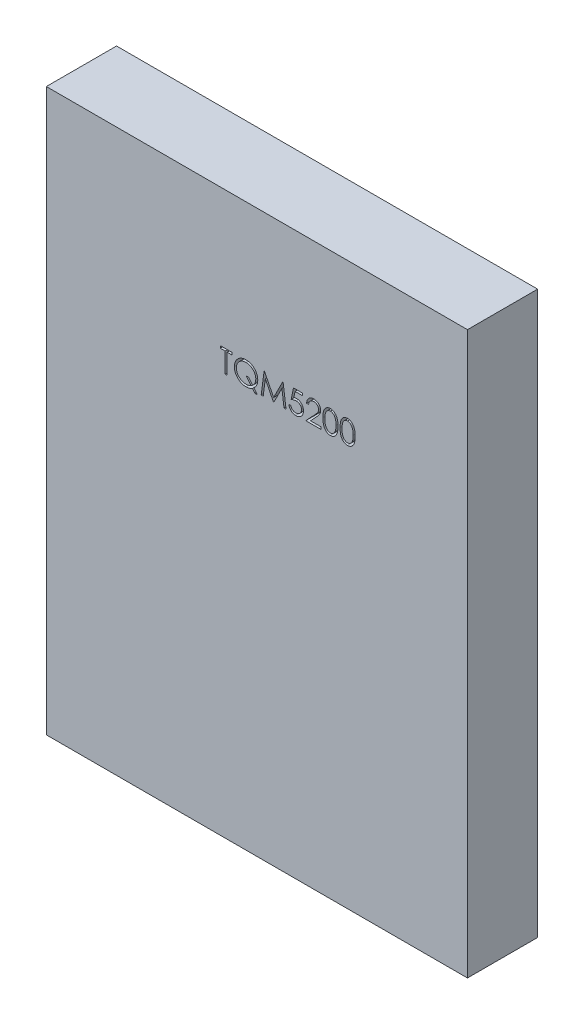
from build123d import *

# Parameters (mm, degrees)
SKETCH1_W      = 60
SKETCH1_H      = 80
EXTRUDE1_DEPTH = 10
EXTRUDE2_DEPTH = 51.990195136


with BuildPart() as part:
    # Sketch1 → Extrude1 (new body)
    with BuildSketch(Plane.XY):
        Rectangle(SKETCH1_W, SKETCH1_H)
    extrude(amount=EXTRUDE1_DEPTH)

    # Sketch2 → Extrude2 (cut, through all)
    # profile 1 of 7: a face of its own
    with BuildSketch(Plane.XY.offset(10)):
        Polygon((-5.209771412, 20.099295067), (-5.209771412, 20.424936093), (-3.540861155, 20.424936093), (-3.540861155, 20.099295067), (-4.232848335, 20.099295067), (-4.232848335, 17.249936093), (-4.517784232, 17.249936093), (-4.517784232, 20.099295067), align=None)
    # profile 2 of 7: a face of its own
    with BuildSketch(Plane.XY.offset(10)):
        with BuildLine():
            Line((-0.405930266, 17.603561894), (0.081895255, 17.005705324))
            Line((0.081895255, 17.005705324), (-0.273638599, 17.005705324))
            Line((-0.273638599, 17.005705324), (-0.625992365, 17.436925275))
            add(Edge.make_bspline(
                [(-0.625992365, 17.436925275), (-0.661332014, 17.415449815), (-0.731360326, 17.37289449), (-0.840550061, 17.318043039), (-0.951911191, 17.272399477), (-1.065197316, 17.234689572), (-1.180243431, 17.204505005), (-1.297632922, 17.183555639), (-1.416940027, 17.171390603), (-1.497097349, 17.169484399), (-1.537405626, 17.168525836)],
                knots=[0, 0, 0, 0, 1.030216282, 2.041455142, 3.041201647, 4.026904037, 5.014869161, 6.002481075, 6.995518502, 8, 8, 8, 8], degree=3))
            add(Edge.make_bspline(
                [(-1.537405626, 17.168525836), (-1.59515465, 17.169916801), (-1.708787537, 17.172653804), (-1.875674715, 17.196548361), (-2.035861283, 17.233451404), (-2.189027956, 17.286846435), (-2.335341583, 17.355047687), (-2.474734186, 17.439130102), (-2.607276616, 17.53792904), (-2.731012344, 17.65079882), (-2.844156116, 17.773585419), (-2.943432686, 17.904777361), (-3.027844593, 18.042197674), (-3.096096649, 18.18653163), (-3.150263777, 18.336522701), (-3.187177206, 18.493418314), (-3.211070838, 18.656284494), (-3.213823443, 18.767176513), (-3.21522013, 18.823443705)],
                knots=[0, 0, 0, 0, 1.055750571, 2.07740284, 3.077223765, 4.05828044, 5.038417088, 6.02463293, 7.030503776, 8.057169806, 9.083586829, 10.080154041, 11.061747002, 12.027853603, 12.995569715, 13.972756451, 14.971366004, 16, 16, 16, 16], degree=3))
            add(Edge.make_bspline(
                [(-3.21522013, 18.823443705), (-3.214723203, 18.861209227), (-3.213732843, 18.936474935), (-3.202276398, 19.047951155), (-3.185254959, 19.157592188), (-3.161178795, 19.26494241), (-3.129661089, 19.370441834), (-3.091874612, 19.473882431), (-3.046091266, 19.574997661), (-2.994334304, 19.673580574), (-2.936610446, 19.768776745), (-2.873730536, 19.859231278), (-2.805539886, 19.94405274), (-2.732086768, 20.02320232), (-2.653664532, 20.09685498), (-2.570947546, 20.166223558), (-2.482172117, 20.228727469), (-2.389681306, 20.286853599), (-2.292956433, 20.337967482), (-2.193889435, 20.38366166), (-2.091739236, 20.420736727), (-1.987831245, 20.452329176), (-1.881535063, 20.476448208), (-1.772933532, 20.493344868), (-1.662103055, 20.504911816), (-1.587256838, 20.505865252), (-1.549489961, 20.506346349)],
                knots=[0, 0, 0, 0, 1.030721839, 2.054201982, 3.056261636, 4.058906239, 5.055198403, 6.060579377, 7.06322398, 8.083343201, 9.098870418, 10.10084648, 11.0888991, 12.067804703, 13.046436456, 14.024708667, 15.012489976, 16.008294399, 17.005242112, 17.997338632, 18.984424362, 19.969624474, 20.960977749, 21.957320355, 22.969278161, 24, 24, 24, 24], degree=3))
            add(Edge.make_bspline(
                [(-1.549489961, 20.506346349), (-1.491740722, 20.504962368), (-1.378317521, 20.502244141), (-1.211843778, 20.47834598), (-1.052129111, 20.441294853), (-0.89928722, 20.388171936), (-0.753454374, 20.319798929), (-0.614691841, 20.235733462), (-0.482784486, 20.136927979), (-0.359695317, 20.024050641), (-0.24681802, 19.900961478), (-0.148012382, 19.76905414), (-0.063947482, 19.630291533), (0.004427623, 19.484458965), (0.057542645, 19.331616029), (0.094671482, 19.171700511), (0.118455533, 19.004997663), (0.12120373, 18.891367584), (0.122600383, 18.833619987)],
                knots=[0, 0, 0, 0, 1.050672203, 2.063587442, 3.054842799, 4.031180399, 5.003107577, 5.981273811, 6.979214548, 7.998088659, 9.016962771, 10.014903508, 10.993069742, 11.96499692, 12.941334519, 13.932589877, 14.949327797, 16, 16, 16, 16], degree=3))
            add(Edge.make_bspline(
                [(0.122600383, 18.833619987), (0.121074008, 18.773533233), (0.118072479, 18.655376034), (0.092528943, 18.482111091), (0.051459423, 18.316602253), (-0.006782117, 18.158957965), (-0.082075265, 18.009206879), (-0.172965416, 17.86585147), (-0.280546894, 17.728901902), (-0.363695658, 17.645781895), (-0.405930266, 17.603561894)],
                knots=[0, 0, 0, 0, 1.045660934, 2.056233022, 3.041853582, 4.009978652, 4.97562384, 5.954545411, 6.961031197, 8, 8, 8, 8], degree=3))
        make_face()
        with BuildLine():
            add(Edge.make_bspline(
                [(-0.597371572, 17.838252399), (-0.562728983, 17.873434096), (-0.494585474, 17.942638054), (-0.406170612, 18.056128883), (-0.33012496, 18.174100301), (-0.269242137, 18.298121607), (-0.220801551, 18.426638996), (-0.187334426, 18.560670791), (-0.166379352, 18.699606815), (-0.163693371, 18.794112373), (-0.162335514, 18.841888216)],
                knots=[0, 0, 0, 0, 1.052210109, 2.069743939, 3.061837814, 4.040478349, 5.010453814, 5.985306305, 6.981502329, 8, 8, 8, 8], degree=3))
            add(Edge.make_bspline(
                [(-0.162335514, 18.841888216), (-0.162690302, 18.872655266), (-0.163391655, 18.933476301), (-0.17303524, 19.023480763), (-0.186678046, 19.111497359), (-0.206428646, 19.197368829), (-0.231862567, 19.280921191), (-0.263275693, 19.362041024), (-0.30005599, 19.440990025), (-0.34293378, 19.517277768), (-0.390202914, 19.590793681), (-0.442819261, 19.660638701), (-0.500042213, 19.726452687), (-0.561246637, 19.789320222), (-0.627612553, 19.847945376), (-0.698901948, 19.902303016), (-0.774236376, 19.953708584), (-0.853988622, 20.000108746), (-0.936173288, 20.042766453), (-1.02030948, 20.079705388), (-1.105690731, 20.110991342), (-1.192184826, 20.136360233), (-1.279679838, 20.156328782), (-1.368329167, 20.169956321), (-1.457903562, 20.179589977), (-1.518087474, 20.180333224), (-1.548217926, 20.180705324)],
                knots=[0, 0, 0, 0, 1.032958288, 2.041976502, 3.037103433, 4.023477888, 4.998866292, 5.968231228, 6.943073582, 7.921783703, 8.90545537, 9.876780072, 10.85618943, 11.833110341, 12.821898168, 13.827467856, 14.842673888, 15.88323808, 16.924703457, 17.951432745, 18.967462636, 19.976958182, 20.977218729, 21.979378626, 22.98839684, 24, 24, 24, 24], degree=3))
            add(Edge.make_bspline(
                [(-1.548217926, 20.180705324), (-1.578559824, 20.180330628), (-1.639165682, 20.179582199), (-1.729172529, 20.170009604), (-1.818025307, 20.15631378), (-1.905333226, 20.136444478), (-1.991405473, 20.111026251), (-2.075974886, 20.079551156), (-2.159776926, 20.043524597), (-2.241072621, 20.000894127), (-2.319719734, 19.95409497), (-2.394518115, 19.903200541), (-2.464442705, 19.847703064), (-2.530156806, 19.788496046), (-2.591496287, 19.725122659), (-2.648750762, 19.658004458), (-2.700914742, 19.58636267), (-2.74870676, 19.511479078), (-2.790947613, 19.433272321), (-2.829043503, 19.353153437), (-2.859985827, 19.270239125), (-2.885388819, 19.18519303), (-2.906146909, 19.098226581), (-2.919526304, 19.008834943), (-2.929242227, 18.917576152), (-2.929934223, 18.855907534), (-2.930284232, 18.82471574)],
                knots=[0, 0, 0, 0, 1.013205451, 2.023808328, 3.020541854, 4.015386314, 5.012622987, 6.016502547, 7.02834558, 8.057881235, 9.080621846, 10.084476421, 11.077781791, 12.060654405, 13.037357686, 14.022218736, 15.005346502, 15.995617173, 16.98763393, 17.973029642, 18.956998942, 19.940662314, 20.93709383, 21.940823471, 22.958474994, 24, 24, 24, 24], degree=3))
            add(Edge.make_bspline(
                [(-2.930284232, 18.82471574), (-2.929092649, 18.778857028), (-2.926748435, 18.688638754), (-2.907315491, 18.556182756), (-2.87473372, 18.42937644), (-2.829150471, 18.308038394), (-2.771926953, 18.191469247), (-2.700765182, 18.080810987), (-2.615968753, 17.976485097), (-2.520745553, 17.877775001), (-2.415998611, 17.788347606), (-2.304956694, 17.709641735), (-2.18856785, 17.642866777), (-2.066466599, 17.588971594), (-1.939563456, 17.545691939), (-1.806856648, 17.516390748), (-1.669213686, 17.496969131), (-1.575422908, 17.495109703), (-1.527865362, 17.494166862)],
                knots=[0, 0, 0, 0, 1.022526523, 2.011626, 2.97850031, 3.937665323, 4.897797383, 5.869804095, 6.865337375, 7.89202157, 8.925035373, 9.93268082, 10.923937058, 11.912550332, 12.905497077, 13.90928476, 14.939882052, 16, 16, 16, 16], degree=3))
            add(Edge.make_bspline(
                [(-1.527865362, 17.494166862), (-1.495191524, 17.494522798), (-1.43056498, 17.495226815), (-1.33526599, 17.504824948), (-1.242299064, 17.518334517), (-1.1525251, 17.538881249), (-1.065165617, 17.564425355), (-0.980740607, 17.595497455), (-0.898802228, 17.63233369), (-0.846702229, 17.661475487), (-0.820613759, 17.676067904)],
                knots=[0, 0, 0, 0, 1.060694673, 2.097979151, 3.107774411, 4.11000626, 5.086069662, 6.061987343, 7.029562652, 8, 8, 8, 8], degree=3))
            Line((-0.820613759, 17.676067904), (-1.535497573, 18.552500195))
            Line((-1.535497573, 18.552500195), (-1.179963719, 18.552500195))
            Line((-1.179963719, 18.552500195), (-0.597371572, 17.838252399))
        make_face(mode=Mode.SUBTRACT)
    # profile 3 of 7: a face of its own
    with BuildSketch(Plane.XY.offset(10)):
        Polygon((0.611061922, 17.249936093), (1.030197539, 20.424936093), (1.070902667, 20.424936093), (2.381734999, 17.819807888), (3.689387242, 20.424936093), (3.730728388, 20.424936093), (4.152408076, 17.249936093), (3.866200143, 17.249936093), (3.562183717, 19.534511413), (2.416079951, 17.249936093), (2.35184217, 17.249936093), (1.201286281, 19.539599554), (0.897905872, 17.249936093), align=None)
    # profile 4 of 7: a face of its own
    with BuildSketch(Plane.XY.offset(10)):
        with BuildLine():
            Line((6.513305511, 20.424936093), (6.513305511, 20.099295067))
            Line((6.513305511, 20.099295067), (5.433347579, 20.099295067))
            Line((5.433347579, 20.099295067), (5.262258837, 19.264203921))
            add(Edge.make_bspline(
                [(5.262258837, 19.264203921), (5.295873809, 19.273484239), (5.3609975, 19.291463388), (5.457118231, 19.311425765), (5.54836973, 19.323459418), (5.607583816, 19.325102535), (5.636237202, 19.325897631)],
                knots=[0, 0, 0, 0, 1.100273476, 2.13160584, 3.095893838, 4, 4, 4, 4], degree=3))
            add(Edge.make_bspline(
                [(5.636237202, 19.325897631), (5.671691737, 19.325130247), (5.741404212, 19.323621377), (5.8434024, 19.309132628), (5.940768667, 19.286327134), (6.033299389, 19.254467803), (6.121165745, 19.21372826), (6.203559319, 19.1628376), (6.281716854, 19.103389506), (6.354236207, 19.035040817), (6.420026116, 18.959819065), (6.477870978, 18.878940139), (6.527004185, 18.793190045), (6.566520012, 18.701749493), (6.598074373, 18.605629404), (6.619076539, 18.503818418), (6.633061697, 18.397276195), (6.634624147, 18.324428478), (6.635420896, 18.287280844)],
                knots=[0, 0, 0, 0, 1.052922333, 2.070308379, 3.05430497, 4.020497103, 4.973039431, 5.925935799, 6.892292201, 7.88610001, 8.88166317, 9.857072816, 10.836096531, 11.812156883, 12.81219415, 13.836441305, 14.89672472, 16, 16, 16, 16], degree=3))
            add(Edge.make_bspline(
                [(6.635420896, 18.287280844), (6.634817578, 18.261407116), (6.633619095, 18.21000932), (6.627524376, 18.133678509), (6.615789833, 18.058963654), (6.600034826, 17.985854841), (6.579585633, 17.914490482), (6.554830563, 17.84466631), (6.524535595, 17.776816917), (6.491305704, 17.710300309), (6.453889257, 17.646620234), (6.412361611, 17.587067225), (6.368487201, 17.530747913), (6.32127823, 17.478266312), (6.270295898, 17.429967289), (6.216157643, 17.385564205), (6.159295462, 17.344306141), (6.098829635, 17.307867849), (6.036107525, 17.274337168), (5.970223357, 17.246829387), (5.902676864, 17.222236266), (5.83249587, 17.202633337), (5.75983934, 17.187273091), (5.684587508, 17.176840403), (5.607135043, 17.169241778), (5.554634139, 17.168766111), (5.528114205, 17.168525836)],
                knots=[0, 0, 0, 0, 1.056347294, 2.098418968, 3.122841568, 4.141288669, 5.149314143, 6.15115421, 7.162517403, 8.180376062, 9.185164535, 10.17417709, 11.141909838, 12.097768115, 13.052685741, 14.0056014, 14.954263652, 15.917497458, 16.885230207, 17.854509472, 18.828990115, 19.81800267, 20.826176721, 21.857883937, 22.917946725, 24, 24, 24, 24], degree=3))
            add(Edge.make_bspline(
                [(5.528114205, 17.168525836), (5.496478341, 17.169152525), (5.434238516, 17.170385461), (5.343052002, 17.183283659), (5.255318038, 17.20175664), (5.171742875, 17.229548113), (5.091577514, 17.264370873), (5.015901192, 17.308381972), (4.942780238, 17.358255873), (4.875187176, 17.417111622), (4.812452702, 17.481442276), (4.756294654, 17.551253851), (4.706280624, 17.62539413), (4.663211525, 17.70422317), (4.626474034, 17.787533837), (4.597613295, 17.875638274), (4.574319359, 17.968076135), (4.564464684, 18.031715391), (4.559459358, 18.064038657)],
                knots=[0, 0, 0, 0, 1.0467383, 2.05933395, 3.04377827, 4.011590433, 4.970194871, 5.932262533, 6.905835911, 7.896367577, 8.894135286, 9.877477877, 10.858688626, 11.851381753, 12.8477658, 13.868841284, 14.917554742, 16, 16, 16, 16], degree=3))
            Line((4.559459358, 18.064038657), (4.844395255, 18.064038657))
            add(Edge.make_bspline(
                [(4.844395255, 18.064038657), (4.851406161, 18.033761446), (4.864881511, 17.975566967), (4.894459583, 17.893804964), (4.930623627, 17.820943954), (4.973626143, 17.756020118), (5.024925099, 17.699406242), (5.08346251, 17.648953621), (5.14909223, 17.603437611), (5.222020374, 17.565498387), (5.298957953, 17.533141732), (5.379482494, 17.511595551), (5.461401436, 17.496445456), (5.516808244, 17.49492893), (5.544650664, 17.494166862)],
                knots=[0, 0, 0, 0, 1.136247022, 2.183929868, 3.172523383, 4.106158343, 5.02341133, 5.958108904, 6.928429099, 7.938127109, 8.96079061, 9.975095812, 10.982467395, 12, 12, 12, 12], degree=3))
            add(Edge.make_bspline(
                [(5.544650664, 17.494166862), (5.571827253, 17.494911425), (5.625338178, 17.496377475), (5.704088508, 17.507661436), (5.780118758, 17.52504009), (5.852678717, 17.551047744), (5.923038114, 17.582656882), (5.989417177, 17.623219843), (6.053736216, 17.669901431), (6.113996022, 17.723383517), (6.169186094, 17.782320312), (6.217950576, 17.845346233), (6.258569633, 17.912580801), (6.29279986, 17.982860018), (6.318792496, 18.056954138), (6.337335386, 18.134515918), (6.348223875, 18.215736936), (6.349721731, 18.271135524), (6.350484999, 18.299365179)],
                knots=[0, 0, 0, 0, 1.027316725, 2.022795036, 3.002884548, 3.971462791, 4.93288096, 5.914575861, 6.907176829, 7.935150275, 8.956128384, 9.956726525, 10.942570165, 11.921478529, 12.907843606, 13.90538589, 14.932640048, 16, 16, 16, 16], degree=3))
            add(Edge.make_bspline(
                [(6.350484999, 18.299365179), (6.349887664, 18.324833897), (6.348718466, 18.374685288), (6.339165734, 18.447618853), (6.322549623, 18.51662797), (6.299486532, 18.582045883), (6.270204407, 18.643934291), (6.234420967, 18.702357067), (6.19146467, 18.756544187), (6.1423956, 18.806521004), (6.088640091, 18.852644569), (6.029273268, 18.891963847), (5.965537477, 18.92504183), (5.898200626, 18.9535878), (5.825661039, 18.974089904), (5.749355237, 18.9894822), (5.668459223, 18.998386137), (5.613150099, 18.999621564), (5.584719774, 19.000256606)],
                knots=[0, 0, 0, 0, 1.045622112, 2.046656509, 3.013763289, 3.955457236, 4.890082067, 5.820317437, 6.762574623, 7.722996705, 8.69280354, 9.665887285, 10.63943826, 11.638615906, 12.663482002, 13.728887084, 14.832589034, 16, 16, 16, 16], degree=3))
            add(Edge.make_bspline(
                [(5.584719774, 19.000256606), (5.56010996, 18.999729926), (5.509296938, 18.998642468), (5.431352659, 18.990635574), (5.349445168, 18.9777185), (5.263888447, 18.959950975), (5.174425557, 18.936699927), (5.081245294, 18.908837487), (4.984151738, 18.875525389), (4.918730659, 18.850368309), (4.885100383, 18.837436093)],
                knots=[0, 0, 0, 0, 0.817624296, 1.688186739, 2.600797293, 3.572016777, 4.590301741, 5.671205678, 6.80286297, 8, 8, 8, 8], degree=3))
            Line((4.885100383, 18.837436093), (5.210741409, 20.424936093))
            Line((5.210741409, 20.424936093), (6.513305511, 20.424936093))
        make_face()
    # profile 5 of 7: a face of its own
    with BuildSketch(Plane.XY.offset(10)):
        with BuildLine():
            Line((7.368113204, 19.448013016), (7.083177306, 19.448013016))
            add(Edge.make_bspline(
                [(7.083177306, 19.448013016), (7.085034367, 19.485814464), (7.088681583, 19.560055502), (7.105761532, 19.668299332), (7.130200756, 19.771763328), (7.164755146, 19.86961675), (7.207668698, 19.96272481), (7.259130937, 20.050717682), (7.320085359, 20.133259689), (7.389215753, 20.209585639), (7.464298733, 20.279605793), (7.545311978, 20.34007162), (7.630442824, 20.391159794), (7.719432993, 20.433869206), (7.813286505, 20.465927495), (7.911151669, 20.489714268), (8.013458457, 20.504025667), (8.083163334, 20.505563987), (8.118614005, 20.506346349)],
                knots=[0, 0, 0, 0, 1.10065271, 2.161652631, 3.183658789, 4.190468796, 5.17591951, 6.163126047, 7.15150782, 8.156236427, 9.156009102, 10.134482811, 11.092018607, 12.041330605, 13.001268258, 13.972401359, 14.968799086, 16, 16, 16, 16], degree=3))
            add(Edge.make_bspline(
                [(8.118614005, 20.506346349), (8.153428401, 20.505531321), (8.221837445, 20.503929819), (8.321679415, 20.4901766), (8.416727389, 20.468635956), (8.506795578, 20.438414114), (8.591165365, 20.397788241), (8.670470555, 20.348986188), (8.745655291, 20.292543912), (8.813334302, 20.226092238), (8.875480916, 20.155151504), (8.929095105, 20.079416049), (8.975008475, 20.001193768), (9.013278727, 19.919888185), (9.041451082, 19.834733752), (9.062839885, 19.746970218), (9.074929753, 19.65568914), (9.076785244, 19.593906764), (9.077728588, 19.562496189)],
                knots=[0, 0, 0, 0, 1.111607364, 2.184268762, 3.212621178, 4.221274766, 5.211760367, 6.196651075, 7.1921475, 8.207485113, 9.220403448, 10.201281604, 11.166441695, 12.114753415, 13.065576456, 14.026450734, 14.996634279, 16, 16, 16, 16], degree=3))
            add(Edge.make_bspline(
                [(9.077728588, 19.562496189), (9.076192557, 19.518274939), (9.07314745, 19.430608459), (9.047099408, 19.301780691), (9.006417216, 19.176963804), (8.957433899, 19.076509251), (8.908019611, 18.995561725), (8.863490229, 18.928915114), (8.811361436, 18.857155153), (8.750874513, 18.78052214), (8.683280693, 18.698415819), (8.607967731, 18.61088579), (8.524398572, 18.518836399), (8.465744075, 18.455966318), (8.435350784, 18.423388617)],
                knots=[0, 0, 0, 0, 1.184426356, 2.348067706, 3.509069118, 4.696110526, 5.333549288, 6.050745305, 6.844228056, 7.710549037, 8.667450064, 9.695053472, 10.805634456, 12, 12, 12, 12], degree=3))
            Line((8.435350784, 18.423388617), (7.640964766, 17.575577118))
            Line((7.640964766, 17.575577118), (9.118433717, 17.575577118))
            Line((9.118433717, 17.575577118), (9.118433717, 17.249936093))
            Line((9.118433717, 17.249936093), (6.961061922, 17.249936093))
            Line((6.961061922, 17.249936093), (8.19239205, 18.563948513))
            add(Edge.make_bspline(
                [(8.19239205, 18.563948513), (8.222371204, 18.595243405), (8.279955025, 18.655354489), (8.361400648, 18.743114174), (8.43455173, 18.824529829), (8.499881794, 18.899447626), (8.555973616, 18.968963406), (8.60575057, 19.030825744), (8.645633641, 19.087752995), (8.688918322, 19.153739123), (8.730841005, 19.234304583), (8.766865785, 19.332760144), (8.788832112, 19.434112723), (8.791467213, 19.502603856), (8.792792691, 19.537055484)],
                knots=[0, 0, 0, 0, 1.329631726, 2.553950428, 3.673215718, 4.687767853, 5.603093632, 6.413772471, 7.123043292, 7.734684054, 8.834405432, 9.900288307, 10.943827018, 12, 12, 12, 12], degree=3))
            add(Edge.make_bspline(
                [(8.792792691, 19.537055484), (8.792215982, 19.558719324), (8.791079399, 19.601414592), (8.781048488, 19.664012674), (8.765889671, 19.724396469), (8.744167902, 19.782751716), (8.715496073, 19.838491701), (8.680595221, 19.891684272), (8.640327092, 19.943109262), (8.593744155, 19.991326897), (8.542570848, 20.035487705), (8.48851035, 20.074607411), (8.431314898, 20.107300033), (8.371225645, 20.134100205), (8.308410112, 20.155123586), (8.242746807, 20.169691012), (8.174417164, 20.178837265), (8.127759636, 20.180074764), (8.1039856, 20.180705324)],
                knots=[0, 0, 0, 0, 0.991446411, 1.95395049, 2.89581595, 3.838931463, 4.798493298, 5.75982156, 6.748411868, 7.785213223, 8.824556874, 9.840280684, 10.836137867, 11.835679398, 12.848801643, 13.863922112, 14.911575587, 16, 16, 16, 16], degree=3))
            add(Edge.make_bspline(
                [(8.1039856, 20.180705324), (8.079156344, 20.180056687), (8.030395786, 20.178782872), (7.958804949, 20.169872313), (7.890509994, 20.154500015), (7.825339125, 20.13347546), (7.763182072, 20.106752348), (7.704341118, 20.073467694), (7.648948354, 20.033749811), (7.596899651, 19.988718735), (7.54894447, 19.938583125), (7.506810518, 19.882694087), (7.469995019, 19.822072075), (7.437873786, 19.756880661), (7.411788267, 19.686528303), (7.391855481, 19.611264742), (7.376083127, 19.531416775), (7.370813969, 19.476276019), (7.368113204, 19.448013016)],
                knots=[0, 0, 0, 0, 1.031018746, 2.02475058, 2.990194455, 3.934040569, 4.864654155, 5.795059489, 6.735614925, 7.690564532, 8.649604399, 9.611025574, 10.590972636, 11.591080095, 12.624614302, 13.701020113, 14.821632451, 16, 16, 16, 16], degree=3))
        make_face()
    # profile 6 of 7: a face of its own
    with BuildSketch(Plane.XY.offset(10)):
        with BuildLine():
            add(Edge.make_bspline(
                [(9.403369614, 18.836164058), (9.403667173, 18.887052402), (9.404245187, 18.985903745), (9.410675397, 19.129944099), (9.421357315, 19.265072361), (9.435996217, 19.391294999), (9.453810671, 19.5086446), (9.477591862, 19.616807558), (9.504636333, 19.716284487), (9.535980338, 19.807399774), (9.571347832, 19.891380976), (9.609841768, 19.96978098), (9.652989832, 20.042481162), (9.698326031, 20.110641871), (9.747685554, 20.173147366), (9.799663742, 20.230880353), (9.856289301, 20.282506534), (9.915637316, 20.329538536), (9.978245109, 20.3707677), (10.042328099, 20.407083113), (10.108327373, 20.438107278), (10.176423125, 20.462500745), (10.246003302, 20.482649156), (10.317311141, 20.496427701), (10.390464379, 20.505097183), (10.439841466, 20.50592601), (10.464883036, 20.506346349)],
                knots=[0, 0, 0, 0, 1.646270934, 3.197905019, 4.663502075, 6.030701355, 7.308322542, 8.50163776, 9.611534131, 10.641858119, 11.616356847, 12.558055219, 13.465016945, 14.349605745, 15.204443733, 16.039544428, 16.859896111, 17.680448484, 18.487036065, 19.28249412, 20.06191084, 20.843045899, 21.620316918, 22.403196591, 23.190181807, 24, 24, 24, 24], degree=3))
            add(Edge.make_bspline(
                [(10.464883036, 20.506346349), (10.490133791, 20.505903831), (10.540349599, 20.505023802), (10.614590511, 20.496565654), (10.687116294, 20.482531135), (10.757617748, 20.46264568), (10.826673986, 20.437975316), (10.89374487, 20.407053431), (10.959247008, 20.37105903), (11.022139483, 20.328764513), (11.083112741, 20.281609162), (11.140669108, 20.228303027), (11.194813822, 20.169384353), (11.24622642, 20.105483519), (11.293448283, 20.035374907), (11.338418468, 19.960277893), (11.378670244, 19.87887918), (11.417436699, 19.792536898), (11.450898465, 19.698862008), (11.481075702, 19.598382546), (11.505458767, 19.489911677), (11.525769035, 19.374018511), (11.541503333, 19.250277437), (11.552962945, 19.118953708), (11.559016386, 18.979960925), (11.560156393, 18.884930591), (11.560741409, 18.836164058)],
                knots=[0, 0, 0, 0, 0.810914788, 1.612654377, 2.396697861, 3.181598691, 3.963628158, 4.749916497, 5.551656086, 6.361998678, 7.18212741, 8.025565596, 8.878627764, 9.750805457, 10.657531673, 11.591944965, 12.560506719, 13.57287815, 14.630710178, 15.753379473, 16.941251878, 18.199788006, 19.531962791, 20.947069417, 22.433333509, 24, 24, 24, 24], degree=3))
            add(Edge.make_bspline(
                [(11.560741409, 18.836164058), (11.560150329, 18.787610227), (11.558998633, 18.693005068), (11.553030806, 18.554637683), (11.541275476, 18.424010886), (11.526570701, 18.300811395), (11.50620447, 18.185551984), (11.481162641, 18.077833806), (11.45335842, 17.977191684), (11.419036856, 17.884450105), (11.381471426, 17.798315327), (11.340599927, 17.717881557), (11.296812299, 17.642437849), (11.249106795, 17.572588078), (11.198258341, 17.507837439), (11.143178633, 17.449328882), (11.085420316, 17.395652629), (11.024267625, 17.347890082), (10.960394289, 17.30608458), (10.895117126, 17.26869773), (10.827277914, 17.238550928), (10.758414022, 17.21266557), (10.687540432, 17.192889445), (10.614745492, 17.179215305), (10.540399478, 17.169625128), (10.490142344, 17.168893536), (10.464883036, 17.168525836)],
                knots=[0, 0, 0, 0, 1.561518951, 3.042555995, 4.452378317, 5.7783523, 7.031515105, 8.214008947, 9.334062868, 10.386615937, 11.391082383, 12.354592575, 13.286541444, 14.194233754, 15.072674879, 15.931287219, 16.775624067, 17.606195743, 18.42308326, 19.229000347, 20.022332153, 20.807536673, 21.593273796, 22.3848459, 23.188221202, 24, 24, 24, 24], degree=3))
            add(Edge.make_bspline(
                [(10.464883036, 17.168525836), (10.439842161, 17.168948887), (10.390466443, 17.169783061), (10.317303172, 17.178413375), (10.246289812, 17.192288581), (10.177075942, 17.211716501), (10.109306461, 17.235497102), (10.043904829, 17.266479373), (9.980143859, 17.302160992), (9.918193662, 17.342796839), (9.859218344, 17.389352937), (9.802886038, 17.440846256), (9.750611914, 17.498561779), (9.701958127, 17.561588181), (9.655717347, 17.629345622), (9.613181987, 17.702759218), (9.573838426, 17.781537872), (9.537876117, 17.866190548), (9.505991258, 17.957952518), (9.477826551, 18.057873558), (9.455588709, 18.1668356), (9.43655417, 18.283963497), (9.421201337, 18.409760562), (9.410719914, 18.54429509), (9.404241721, 18.687483244), (9.403665621, 18.785699396), (9.403369614, 18.836164058)],
                knots=[0, 0, 0, 0, 0.810891512, 1.598919785, 2.382837074, 3.152667961, 3.926044502, 4.706494248, 5.493654104, 6.291793342, 7.103789334, 7.925228297, 8.761435821, 9.622817696, 10.50288917, 11.416980706, 12.369136599, 13.353924996, 14.394355917, 15.514179734, 16.714354668, 17.994756427, 19.357759367, 20.818452758, 22.365282078, 24, 24, 24, 24], degree=3))
        make_face()
        with BuildLine():
            add(Edge.make_bspline(
                [(9.688305511, 18.837436093), (9.688413867, 18.795028345), (9.688624164, 18.712723232), (9.694118003, 18.59312256), (9.701602142, 18.481570905), (9.711255319, 18.377926625), (9.725590851, 18.282540542), (9.741653437, 18.194756616), (9.761200632, 18.115039408), (9.784328256, 18.042841894), (9.810670865, 17.97693881), (9.839432613, 17.915614851), (9.870330554, 17.858145594), (9.904910069, 17.805047249), (9.942570162, 17.756146658), (9.98246019, 17.710578303), (10.026068892, 17.669941041), (10.086397287, 17.621203108), (10.166041231, 17.570839322), (10.266389787, 17.526982512), (10.369503311, 17.499421284), (10.439490516, 17.495916305), (10.4744233, 17.494166862)],
                knots=[0, 0, 0, 0, 1.459021318, 2.831673884, 4.118529203, 5.306027144, 6.411944654, 7.436330062, 8.375795394, 9.233974572, 10.042671642, 10.816086306, 11.563610507, 12.285937304, 12.993564865, 13.685989202, 14.367179055, 15.041617293, 16.353048772, 17.594441528, 18.799311195, 20, 20, 20, 20], degree=3))
            add(Edge.make_bspline(
                [(10.4744233, 17.494166862), (10.509582045, 17.495616277), (10.579826945, 17.498512116), (10.682455459, 17.52645097), (10.782087204, 17.568605481), (10.86016675, 17.618450718), (10.919568772, 17.665919989), (10.962129184, 17.706391848), (11.001192614, 17.751708956), (11.03824221, 17.800603318), (11.072222943, 17.854009071), (11.103123075, 17.911669407), (11.131320112, 17.973744447), (11.147384747, 18.017078425), (11.15559818, 18.039233969)],
                knots=[0, 0, 0, 0, 1.353760809, 2.704726607, 4.075137775, 5.516104923, 6.260822281, 7.007110065, 7.778089737, 8.566572457, 9.372053459, 10.217411131, 11.088608312, 12, 12, 12, 12], degree=3))
            add(Edge.make_bspline(
                [(11.15559818, 18.039233969), (11.165170141, 18.067563804), (11.184605326, 18.125085519), (11.20965315, 18.214315404), (11.229379333, 18.307935054), (11.247126101, 18.405384981), (11.25923923, 18.507383853), (11.268989032, 18.613616072), (11.27473187, 18.724161737), (11.275443751, 18.799268622), (11.275805511, 18.837436093)],
                knots=[0, 0, 0, 0, 0.884706709, 1.796334032, 2.740027952, 3.714592787, 4.726048262, 5.777819803, 6.87074269, 8, 8, 8, 8], degree=3))
            add(Edge.make_bspline(
                [(11.275805511, 18.837436093), (11.275306411, 18.875597391), (11.274330064, 18.950249047), (11.27059809, 19.059576254), (11.26096099, 19.163414866), (11.250257504, 19.262212223), (11.234475739, 19.355421426), (11.217459728, 19.443822775), (11.194598629, 19.52632109), (11.170178547, 19.604207996), (11.142229117, 19.67659859), (11.111462701, 19.743830382), (11.078604391, 19.806227954), (11.042915359, 19.863620108), (11.004819275, 19.916263915), (10.963310641, 19.963103868), (10.92003596, 20.005591689), (10.859423227, 20.054089877), (10.78007155, 20.103539772), (10.681332998, 20.149047283), (10.578580342, 20.17518052), (10.50911728, 20.17886505), (10.4744233, 20.180705324)],
                knots=[0, 0, 0, 0, 1.31362396, 2.569729283, 3.763502607, 4.902122613, 5.988968491, 7.01645872, 7.998833611, 8.933434873, 9.825090667, 10.667526885, 11.477055099, 12.250526234, 12.991942729, 13.710640831, 14.402115721, 15.076753259, 16.378508321, 17.609869233, 18.806226677, 20, 20, 20, 20], degree=3))
            add(Edge.make_bspline(
                [(10.4744233, 20.180705324), (10.439307263, 20.178862511), (10.369011216, 20.175173529), (10.265190571, 20.149144649), (10.165673052, 20.103775745), (10.086531211, 20.053926092), (10.025876204, 20.006447767), (9.983165475, 19.965275769), (9.943118591, 19.920239524), (9.906227177, 19.870889216), (9.871674756, 19.817852776), (9.83994198, 19.760712968), (9.811351259, 19.69918023), (9.78496743, 19.633306749), (9.761769258, 19.561115464), (9.74263402, 19.481496448), (9.724956479, 19.393991732), (9.712442199, 19.298089036), (9.701317221, 19.194418797), (9.694167713, 19.082588658), (9.688605786, 18.962787399), (9.688407608, 18.880056733), (9.688305511, 18.837436093)],
                knots=[0, 0, 0, 0, 1.207732386, 2.417664972, 3.655092373, 4.956220595, 5.625982001, 6.301752483, 6.994047911, 7.697131622, 8.419323945, 9.170223765, 9.943494443, 10.752040957, 11.610060368, 12.549350801, 13.567764191, 14.679664412, 15.874934091, 17.154273443, 18.533957287, 20, 20, 20, 20], degree=3))
        make_face(mode=Mode.SUBTRACT)
    # profile 7 of 7: a face of its own
    with BuildSketch(Plane.XY.offset(10)):
        with BuildLine():
            add(Edge.make_bspline(
                [(11.845677306, 18.836164058), (11.845974866, 18.887052402), (11.846552879, 18.985903745), (11.852983089, 19.129944099), (11.863665007, 19.265072361), (11.87830391, 19.391294999), (11.896118363, 19.5086446), (11.919899554, 19.616807558), (11.946944025, 19.716284487), (11.97828803, 19.807399774), (12.013655524, 19.891380976), (12.052149461, 19.96978098), (12.095297524, 20.042481162), (12.140633724, 20.110641871), (12.189993246, 20.173147366), (12.241971434, 20.230880353), (12.298596994, 20.282506534), (12.357945008, 20.329538536), (12.420552801, 20.3707677), (12.484635791, 20.407083113), (12.550635066, 20.438107278), (12.618730817, 20.462500745), (12.688310995, 20.482649156), (12.759618834, 20.496427701), (12.832772071, 20.505097183), (12.882149158, 20.50592601), (12.907190728, 20.506346349)],
                knots=[0, 0, 0, 0, 1.646270934, 3.197905019, 4.663502075, 6.030701355, 7.308322542, 8.50163776, 9.611534131, 10.641858119, 11.616356847, 12.558055219, 13.465016945, 14.349605745, 15.204443733, 16.039544428, 16.859896111, 17.680448484, 18.487036065, 19.28249412, 20.06191084, 20.843045899, 21.620316918, 22.403196591, 23.190181807, 24, 24, 24, 24], degree=3))
            add(Edge.make_bspline(
                [(12.907190728, 20.506346349), (12.932441483, 20.505903831), (12.982657291, 20.505023802), (13.056898203, 20.496565654), (13.129423986, 20.482531135), (13.19992544, 20.46264568), (13.268981678, 20.437975316), (13.336052562, 20.407053431), (13.4015547, 20.37105903), (13.464447176, 20.328764513), (13.525420434, 20.281609162), (13.5829768, 20.228303027), (13.637121514, 20.169384353), (13.688534112, 20.105483519), (13.735755975, 20.035374907), (13.78072616, 19.960277893), (13.820977936, 19.87887918), (13.859744391, 19.792536898), (13.893206158, 19.698862008), (13.923383394, 19.598382546), (13.947766459, 19.489911677), (13.968076727, 19.374018511), (13.983811026, 19.250277437), (13.995270637, 19.118953708), (14.001324078, 18.979960925), (14.002464086, 18.884930591), (14.003049101, 18.836164058)],
                knots=[0, 0, 0, 0, 0.810914788, 1.612654377, 2.396697861, 3.181598691, 3.963628158, 4.749916497, 5.551656086, 6.361998678, 7.18212741, 8.025565596, 8.878627764, 9.750805457, 10.657531673, 11.591944965, 12.560506719, 13.57287815, 14.630710178, 15.753379473, 16.941251878, 18.199788006, 19.531962791, 20.947069417, 22.433333509, 24, 24, 24, 24], degree=3))
            add(Edge.make_bspline(
                [(14.003049101, 18.836164058), (14.002458021, 18.787610227), (14.001306325, 18.693005068), (13.995338498, 18.554637683), (13.983583169, 18.424010886), (13.968878393, 18.300811395), (13.948512163, 18.185551984), (13.923470333, 18.077833806), (13.895666112, 17.977191684), (13.861344549, 17.884450105), (13.823779119, 17.798315327), (13.782907619, 17.717881557), (13.739119991, 17.642437849), (13.691414487, 17.572588078), (13.640566034, 17.507837439), (13.585486325, 17.449328882), (13.527728009, 17.395652629), (13.466575317, 17.347890082), (13.402701981, 17.30608458), (13.337424819, 17.26869773), (13.269585607, 17.238550928), (13.200721714, 17.21266557), (13.129848125, 17.192889445), (13.057053184, 17.179215305), (12.98270717, 17.169625128), (12.932450036, 17.168893536), (12.907190728, 17.168525836)],
                knots=[0, 0, 0, 0, 1.561518951, 3.042555995, 4.452378317, 5.7783523, 7.031515105, 8.214008947, 9.334062868, 10.386615937, 11.391082383, 12.354592575, 13.286541444, 14.194233754, 15.072674879, 15.931287219, 16.775624067, 17.606195743, 18.42308326, 19.229000347, 20.022332153, 20.807536673, 21.593273796, 22.3848459, 23.188221202, 24, 24, 24, 24], degree=3))
            add(Edge.make_bspline(
                [(12.907190728, 17.168525836), (12.882149853, 17.168948887), (12.832774136, 17.169783061), (12.759610864, 17.178413375), (12.688597504, 17.192288581), (12.619383635, 17.211716501), (12.551614153, 17.235497102), (12.486212522, 17.266479373), (12.422451552, 17.302160992), (12.360501354, 17.342796839), (12.301526037, 17.389352937), (12.245193731, 17.440846256), (12.192919606, 17.498561779), (12.144265819, 17.561588181), (12.098025039, 17.629345622), (12.055489679, 17.702759218), (12.016146119, 17.781537872), (11.980183809, 17.866190548), (11.94829895, 17.957952518), (11.920134244, 18.057873558), (11.897896401, 18.1668356), (11.878861863, 18.283963497), (11.86350903, 18.409760562), (11.853027606, 18.54429509), (11.846549413, 18.687483244), (11.845973313, 18.785699396), (11.845677306, 18.836164058)],
                knots=[0, 0, 0, 0, 0.810891512, 1.598919785, 2.382837074, 3.152667961, 3.926044502, 4.706494248, 5.493654104, 6.291793342, 7.103789334, 7.925228297, 8.761435821, 9.622817696, 10.50288917, 11.416980706, 12.369136599, 13.353924996, 14.394355917, 15.514179734, 16.714354668, 17.994756427, 19.357759367, 20.818452758, 22.365282078, 24, 24, 24, 24], degree=3))
        make_face()
        with BuildLine():
            add(Edge.make_bspline(
                [(12.130613204, 18.837436093), (12.130721559, 18.795028345), (12.130931856, 18.712723232), (12.136425695, 18.59312256), (12.143909834, 18.481570905), (12.153563011, 18.377926625), (12.167898543, 18.282540542), (12.183961129, 18.194756616), (12.203508325, 18.115039408), (12.226635948, 18.042841894), (12.252978557, 17.97693881), (12.281740305, 17.915614851), (12.312638247, 17.858145594), (12.347217762, 17.805047249), (12.384877855, 17.756146658), (12.424767883, 17.710578303), (12.468376584, 17.669941041), (12.528704979, 17.621203108), (12.608348924, 17.570839322), (12.70869748, 17.526982512), (12.811811003, 17.499421284), (12.881798208, 17.495916305), (12.916730992, 17.494166862)],
                knots=[0, 0, 0, 0, 1.459021318, 2.831673884, 4.118529203, 5.306027144, 6.411944654, 7.436330062, 8.375795394, 9.233974572, 10.042671642, 10.816086306, 11.563610507, 12.285937304, 12.993564865, 13.685989202, 14.367179055, 15.041617293, 16.353048772, 17.594441528, 18.799311195, 20, 20, 20, 20], degree=3))
            add(Edge.make_bspline(
                [(12.916730992, 17.494166862), (12.951889737, 17.495616277), (13.022134638, 17.498512116), (13.124763152, 17.52645097), (13.224394897, 17.568605481), (13.302474443, 17.618450718), (13.361876464, 17.665919989), (13.404436877, 17.706391848), (13.443500306, 17.751708956), (13.480549903, 17.800603318), (13.514530636, 17.854009071), (13.545430768, 17.911669407), (13.573627804, 17.973744447), (13.589692439, 18.017078425), (13.597905872, 18.039233969)],
                knots=[0, 0, 0, 0, 1.353760809, 2.704726607, 4.075137775, 5.516104923, 6.260822281, 7.007110065, 7.778089737, 8.566572457, 9.372053459, 10.217411131, 11.088608312, 12, 12, 12, 12], degree=3))
            add(Edge.make_bspline(
                [(13.597905872, 18.039233969), (13.607477833, 18.067563804), (13.626913018, 18.125085519), (13.651960842, 18.214315404), (13.671687026, 18.307935054), (13.689433793, 18.405384981), (13.701546922, 18.507383853), (13.711296724, 18.613616072), (13.717039562, 18.724161737), (13.717751443, 18.799268622), (13.718113204, 18.837436093)],
                knots=[0, 0, 0, 0, 0.884706709, 1.796334032, 2.740027952, 3.714592787, 4.726048262, 5.777819803, 6.87074269, 8, 8, 8, 8], degree=3))
            add(Edge.make_bspline(
                [(13.718113204, 18.837436093), (13.717614104, 18.875597391), (13.716637757, 18.950249047), (13.712905782, 19.059576254), (13.703268683, 19.163414866), (13.692565196, 19.262212223), (13.676783431, 19.355421426), (13.659767421, 19.443822775), (13.636906321, 19.52632109), (13.612486239, 19.604207996), (13.584536809, 19.67659859), (13.553770393, 19.743830382), (13.520912083, 19.806227954), (13.485223051, 19.863620108), (13.447126967, 19.916263915), (13.405618333, 19.963103868), (13.362343652, 20.005591689), (13.301730919, 20.054089877), (13.222379242, 20.103539772), (13.123640691, 20.149047283), (13.020888035, 20.17518052), (12.951424973, 20.17886505), (12.916730992, 20.180705324)],
                knots=[0, 0, 0, 0, 1.31362396, 2.569729283, 3.763502607, 4.902122613, 5.988968491, 7.01645872, 7.998833611, 8.933434873, 9.825090667, 10.667526885, 11.477055099, 12.250526234, 12.991942729, 13.710640831, 14.402115721, 15.076753259, 16.378508321, 17.609869233, 18.806226677, 20, 20, 20, 20], degree=3))
            add(Edge.make_bspline(
                [(12.916730992, 20.180705324), (12.881614955, 20.178862511), (12.811318908, 20.175173529), (12.707498263, 20.149144649), (12.607980744, 20.103775745), (12.528838903, 20.053926092), (12.468183897, 20.006447767), (12.425473168, 19.965275769), (12.385426283, 19.920239524), (12.348534869, 19.870889216), (12.313982448, 19.817852776), (12.282249672, 19.760712968), (12.253658952, 19.69918023), (12.227275123, 19.633306749), (12.204076951, 19.561115464), (12.184941712, 19.481496448), (12.167264171, 19.393991732), (12.154749892, 19.298089036), (12.143624913, 19.194418797), (12.136475405, 19.082588658), (12.130913478, 18.962787399), (12.1307153, 18.880056733), (12.130613204, 18.837436093)],
                knots=[0, 0, 0, 0, 1.207732386, 2.417664972, 3.655092373, 4.956220595, 5.625982001, 6.301752483, 6.994047911, 7.697131622, 8.419323945, 9.170223765, 9.943494443, 10.752040957, 11.610060368, 12.549350801, 13.567764191, 14.679664412, 15.874934091, 17.154273443, 18.533957287, 20, 20, 20, 20], degree=3))
        make_face(mode=Mode.SUBTRACT)
    extrude(amount=-EXTRUDE2_DEPTH, mode=Mode.SUBTRACT)


with BuildPart() as extrude2_piece_1:
    # of the separate pieces the step leaves, piece 1, a body of its own (extrude2_pieces)
    add(part.part.solids().sort_by_distance((-30, -40, 0))[0])


with BuildPart() as extrude2_piece_2:
    # of the separate pieces the step leaves, piece 2, a body of its own (extrude2_pieces)
    add(part.part.solids().sort_by_distance((-0.162335514, 18.841888216, 0))[0])


with BuildPart() as extrude2_piece_3:
    # of the separate pieces the step leaves, piece 3, a body of its own (extrude2_pieces)
    add(part.part.solids().sort_by_distance((10.4744233, 17.494166862, 0))[0])


with BuildPart() as extrude2_piece_4:
    # of the separate pieces the step leaves, piece 4, a body of its own (extrude2_pieces)
    add(part.part.solids().sort_by_distance((12.916730992, 17.494166862, 0))[0])


solid = Compound([extrude2_piece_1.part, extrude2_piece_2.part, extrude2_piece_3.part, extrude2_piece_4.part])
